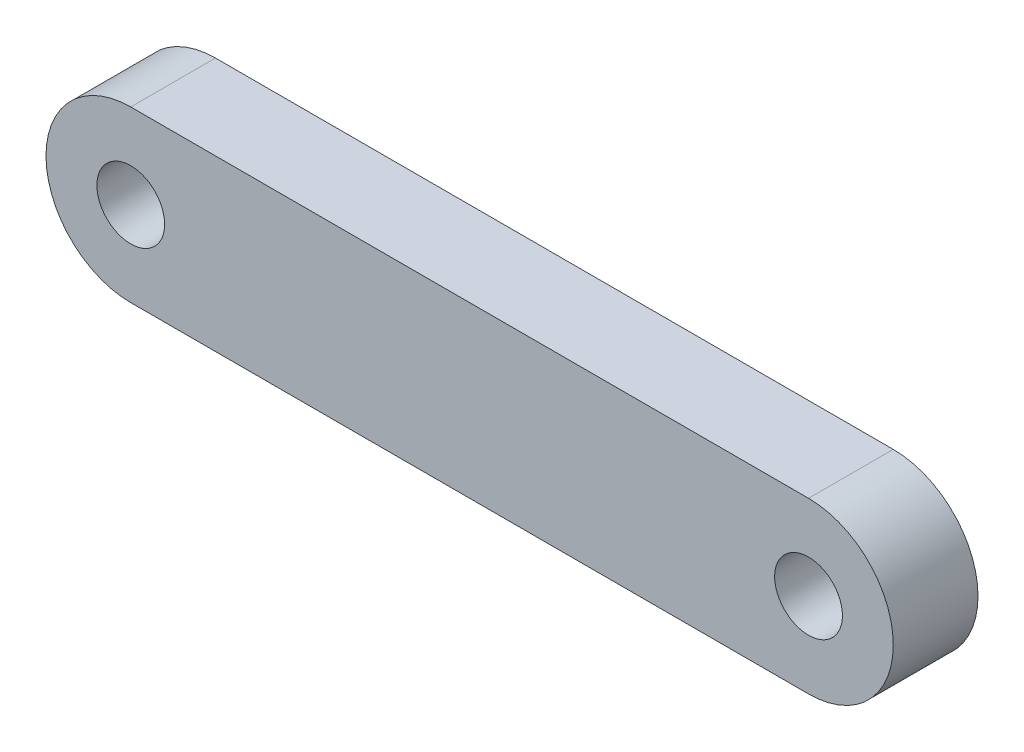
from build123d import *

# Parameters (mm, degrees)
ESQUISSE1_R        = 2
BOSS_EXTRU_1_DEPTH = 5


with BuildPart() as part:
    # Esquisse1 → Boss.-Extru.1 (new body)
    with BuildSketch(Plane.XY):
        with BuildLine():
            Line((-20, 5), (20, 5))
            ThreePointArc((20, 5), (25, 0), (20, -5))
            Line((20, -5), (-20, -5))
            ThreePointArc((-20, -5), (-25, 0), (-20, 5))
        make_face()
        with Locations((-20, 0)):
            Circle(ESQUISSE1_R, mode=Mode.SUBTRACT)
        with Locations((20, 0)):
            Circle(ESQUISSE1_R, mode=Mode.SUBTRACT)
    extrude(amount=BOSS_EXTRU_1_DEPTH)


solid = part.part
